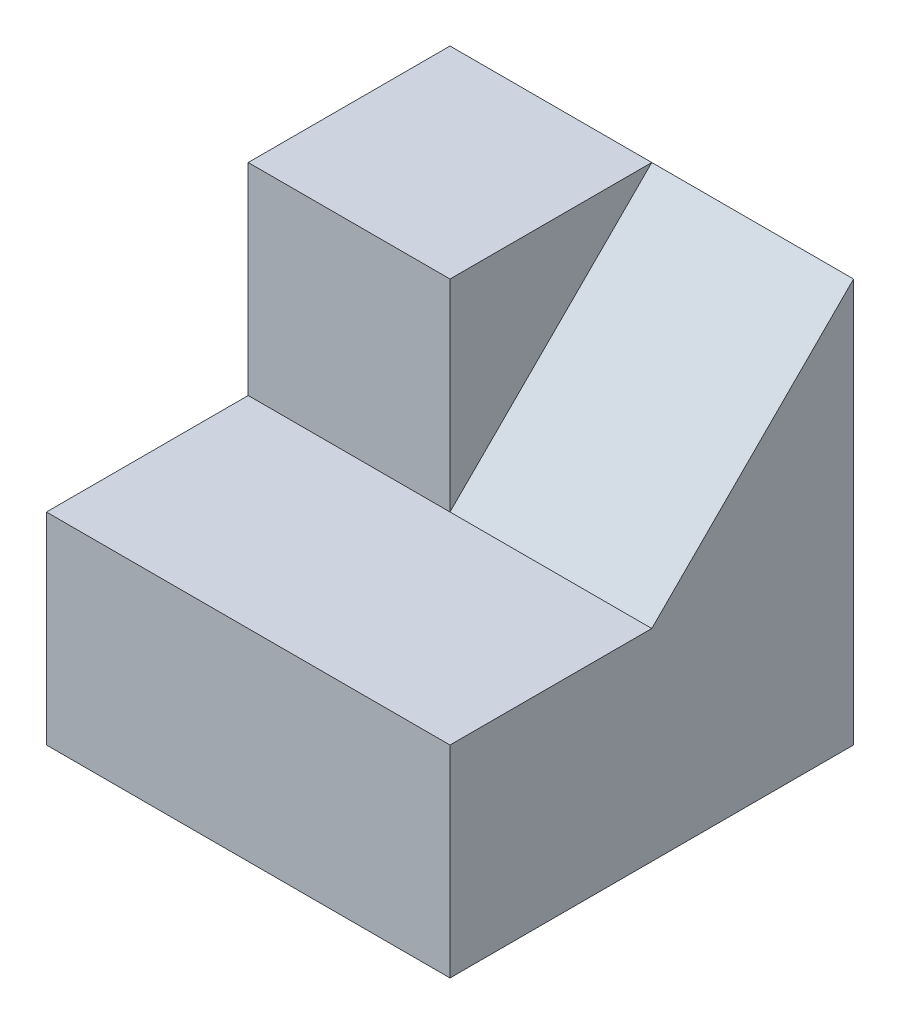
from build123d import *

# Parameters (mm, degrees)
CROQUIS1_W              = 40
CROQUIS1_H              = 40
SALIENTE_EXTRUIR1_DEPTH = 20
CROQUIS2_W              = 20
CROQUIS2_H              = 20
SALIENTE_EXTRUIR2_DEPTH = 20
SALIENTE_EXTRUIR3_DEPTH = 20


with BuildPart() as part:
    # Croquis1 → Saliente-Extruir1 (new body)
    with BuildSketch(Plane(origin=(0, 0, 0), x_dir=(1, 0, 0), z_dir=(0, 1, 0))):
        Rectangle(CROQUIS1_W, CROQUIS1_H)
    extrude(amount=SALIENTE_EXTRUIR1_DEPTH)

    # Croquis2 → Saliente-Extruir2 (add)
    with BuildSketch(Plane(origin=(0, 20, 0), x_dir=(1, 0, 0), z_dir=(0, 1, 0))):
        with Locations((-10, 10)):
            Rectangle(CROQUIS2_W, CROQUIS2_H)
    extrude(amount=SALIENTE_EXTRUIR2_DEPTH)

    # Croquis3 → Saliente-Extruir3 (add)
    with BuildSketch(Plane(origin=(20, 0, 0), x_dir=(0, 0, -1), z_dir=(1, 0, 0))):
        Polygon((20, 20), (20, 40), (0, 20), align=None)
    extrude(amount=-SALIENTE_EXTRUIR3_DEPTH)


solid = part.part
